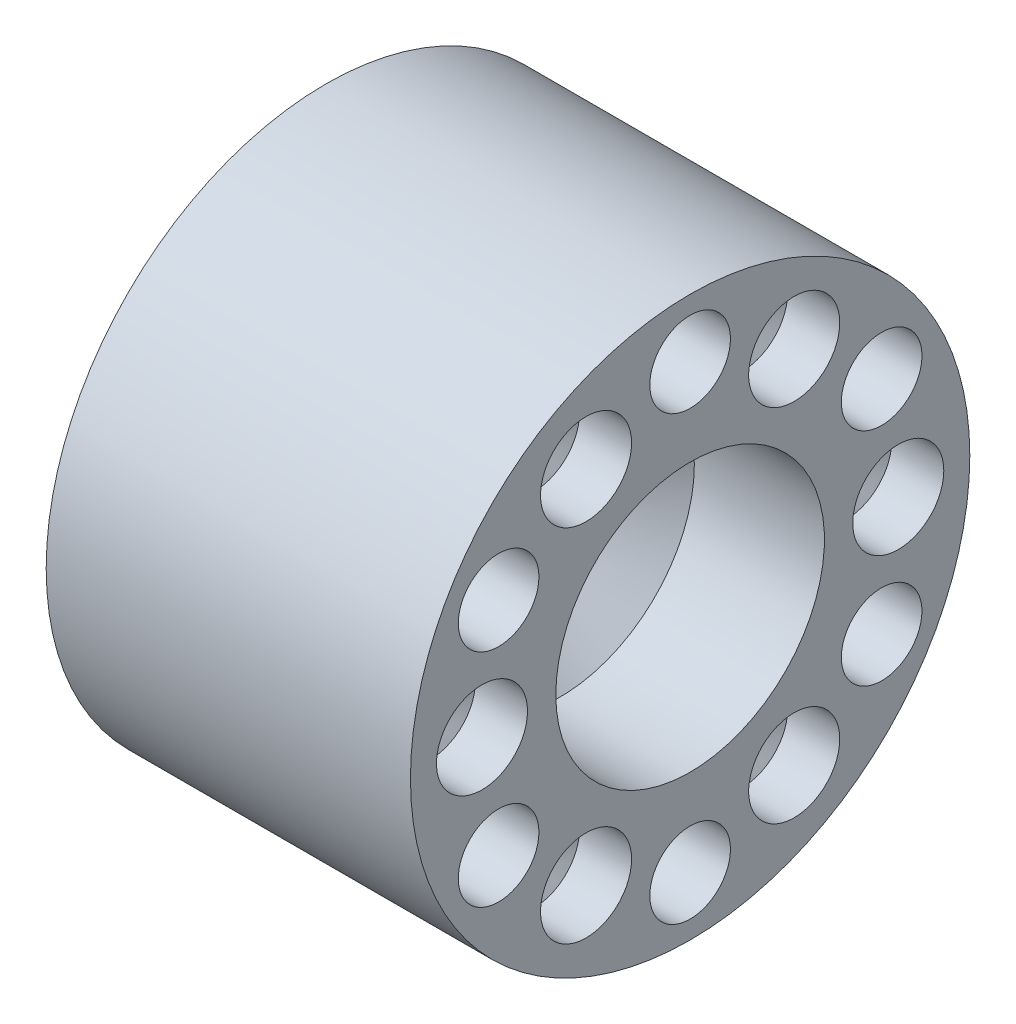
from build123d import *

# Parameters (mm, degrees)
SKETCH11_R                   = 3.1
EXTRUDE1_DEPTH               = 12
M6_TAPPED_HOLE1_D            = 5
M6_TAPPED_HOLE1_DEPTH        = 35
M6_TAPPED_HOLE1_TIP          = 1.502151548
F_7_0_7_DIAMETER_HOLE1_D     = 7
F_7_0_7_DIAMETER_HOLE1_DEPTH = 4
F_7_0_7_DIAMETER_HOLE1_TIP   = 2.103012167
EXTRUDE3_DEPTH               = 1


with BuildPart() as part:
    # Sketch1 → Revolve1 (revolve)
    with BuildSketch(Plane.XY, mode=Mode.PRIVATE) as revolve1_sk:
        Polygon((4, 18.5), (0, 15), (0, 8.3175), (18.175, 6.5), (22, 10.325), (32, 10.325), (32, 21.5), (4, 21.5), align=None)
    revolve(revolve1_sk.sketch.rotate(Axis((0, 0, 0), (1, 0, 0)), 90), axis=Axis((0, 0, 0), (1, 0, 0)))

    # Sketch11 → Extrude1 (cut)
    with BuildSketch(Plane(origin=(32, 0, 0), x_dir=(0, 0, -1), z_dir=(1, 0, 0))):
        with Locations((0, -17)):
            Circle(SKETCH11_R)
        with Locations((-14.722431864, -8.5)):
            Circle(SKETCH11_R)
        with Locations((-14.722431864, 8.5)):
            Circle(SKETCH11_R)
        with Locations((0, 17)):
            Circle(SKETCH11_R)
        with Locations((14.722431864, 8.5)):
            Circle(SKETCH11_R)
        with Locations((14.722431864, -8.5)):
            Circle(SKETCH11_R)
    extrude(amount=-EXTRUDE1_DEPTH, mode=Mode.SUBTRACT)

    # M6 Tapped Hole1
    with Locations(Plane(origin=(20, -17, 0), x_dir=(0, 0, 1), z_dir=(1, 0, 0))):
        with Locations((0, 0), (14.722431864, -8.5), (14.722431864, -25.5), (0, -34), (-14.722431864, -25.5), (-14.722431864, -8.5)):
            Hole(M6_TAPPED_HOLE1_D / 2, depth=M6_TAPPED_HOLE1_DEPTH)
            with Locations((0, 0, -(M6_TAPPED_HOLE1_DEPTH + M6_TAPPED_HOLE1_TIP / 2))):  # 118° drill point
                Cone(0, M6_TAPPED_HOLE1_D / 2, M6_TAPPED_HOLE1_TIP, mode=Mode.SUBTRACT)

    # Ø7.0 (7) Diameter Hole1
    with Locations(Plane(origin=(32, -13.856406461, -8), x_dir=(0, 0, 1), z_dir=(1, 0, 0))):
        with Locations((0, 0), (16, 0), (24, -13.856406461), (16, -27.712812922), (0, -27.712812922), (-8, -13.856406461)):
            Hole(F_7_0_7_DIAMETER_HOLE1_D / 2, depth=F_7_0_7_DIAMETER_HOLE1_DEPTH)
            with Locations((0, 0, -(F_7_0_7_DIAMETER_HOLE1_DEPTH + F_7_0_7_DIAMETER_HOLE1_TIP / 2))):  # 118° drill point
                Cone(0, F_7_0_7_DIAMETER_HOLE1_D / 2, F_7_0_7_DIAMETER_HOLE1_TIP, mode=Mode.SUBTRACT)

    # Sketch18 → Extrude3 (cut, symmetric)
    with BuildSketch(Plane.XY):
        Polygon((21.070558224, 5.305955372), (-1.084590537, 7.521470248), (-0.78607938, 10.506581818), (21.369069381, 8.291066942), align=None)
    extrude(amount=EXTRUDE3_DEPTH, both=True, mode=Mode.SUBTRACT)


solid = part.part
